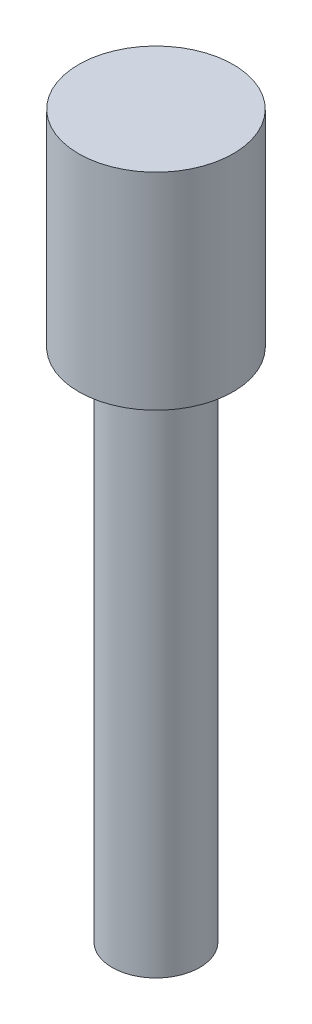
from build123d import *

# Parameters (mm, degrees)
SKETCH1_R           = 10.795
BOSS_EXTRUDE1_DEPTH = 127
SKETCH2_R           = 19.05
BOSS_EXTRUDE2_DEPTH = 50.8


with BuildPart() as part:
    # Sketch1 → Boss-Extrude1 (new body)
    with BuildSketch(Plane(origin=(0, 0, 0), x_dir=(1, 0, 0), z_dir=(0, 1, 0))):
        with Locations(Location((0, 0, 0), (0, 0, 270))):
            Circle(SKETCH1_R)
    extrude(amount=BOSS_EXTRUDE1_DEPTH)

    # Sketch2 → Boss-Extrude2 (add)
    with BuildSketch(Plane(origin=(0, 127, 0), x_dir=(1, 0, 0), z_dir=(0, 1, 0))):
        with Locations(Location((0, 0, 0), (0, 0, 270))):
            Circle(SKETCH2_R)
    extrude(amount=BOSS_EXTRUDE2_DEPTH)


solid = part.part
